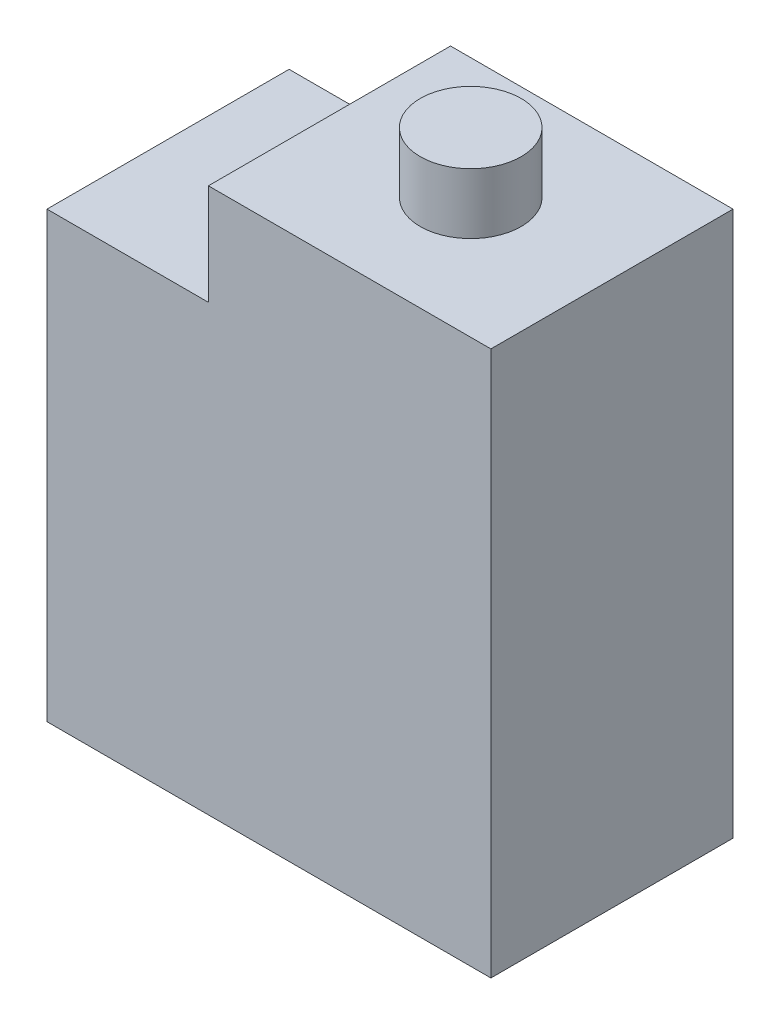
from build123d import *

# Parameters (mm, degrees)
CROQUIS1_W              = 22
CROQUIS1_H              = 12
SALIENTE_EXTRUIR1_DEPTH = 22
CROQUIS2_W              = 14
CROQUIS2_H              = 12
SALIENTE_EXTRUIR2_DEPTH = 5
CROQUIS3_R              = 2.5
SALIENTE_EXTRUIR3_DEPTH = 3


with BuildPart() as part:
    # Croquis1 → Saliente-Extruir1 (new body)
    with BuildSketch(Plane(origin=(0, 0, 0), x_dir=(1, 0, 0), z_dir=(0, 1, 0))):
        Rectangle(CROQUIS1_W, CROQUIS1_H)
    extrude(amount=SALIENTE_EXTRUIR1_DEPTH)

    # Croquis2 → Saliente-Extruir2 (add)
    with BuildSketch(Plane(origin=(0, 22, 0), x_dir=(1, 0, 0), z_dir=(0, 1, 0))):
        with Locations((4, 0)):
            Rectangle(CROQUIS2_W, CROQUIS2_H)
    extrude(amount=SALIENTE_EXTRUIR2_DEPTH)

    # Croquis3 → Saliente-Extruir3 (add)
    with BuildSketch(Plane(origin=(0, 27, 0), x_dir=(1, 0, 0), z_dir=(0, 1, 0))):
        with Locations(Location((4, 0, 0), (0, 0, 270))):
            Circle(CROQUIS3_R)
    extrude(amount=SALIENTE_EXTRUIR3_DEPTH)


solid = part.part
